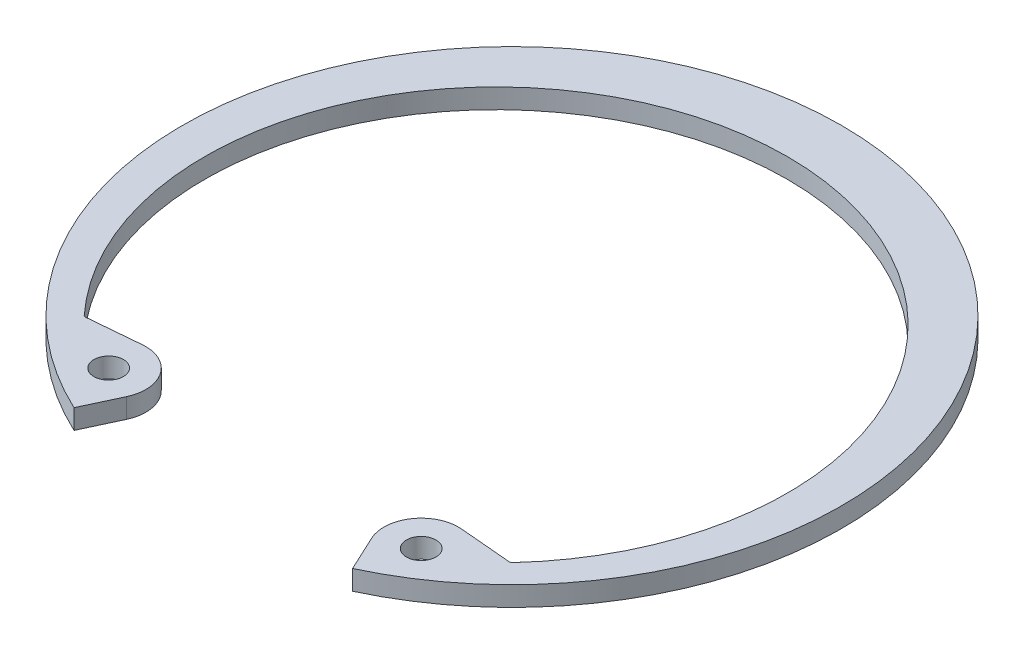
from build123d import *

# Parameters (mm, degrees)
SKETCH2_R      = 1.1811
EXTRUDE1_DEPTH = 1.5748
FILLET1_R      = 0.254


with BuildPart() as part:
    # Sketch2 → Extrude1 (new body)
    with BuildSketch(Plane(origin=(0, 0, 0), x_dir=(1, 0, 0), z_dir=(0, 1, 0))):
        with BuildLine():
            Line((11.120945987, -23.848945631), (9.784734318, -20.98343046))
            ThreePointArc((9.784734318, -20.98343046), (10.043743754, -18.022939056), (12.737109235, -16.767002106))
            Line((12.737109235, -16.767002106), (17.019050922, -17.141623461))
            ThreePointArc((17.019050922, -17.141623461), (0, 21.9964), (-17.019050922, -17.141623461))
            Line((-17.019050922, -17.141623461), (-12.737109235, -16.767002106))
            ThreePointArc((-12.737109235, -16.767002106), (-10.043743754, -18.022939056), (-9.784734318, -20.98343046))
            Line((-9.784734318, -20.98343046), (-11.120945987, -23.848945631))
            ThreePointArc((-11.120945987, -23.848945631), (0, 26.3144), (11.120945987, -23.848945631))
        make_face()
        with Locations(Location((12.478099799, -19.727493509, 0), (0, 0, 270))):
            Circle(SKETCH2_R, mode=Mode.SUBTRACT)
        with Locations(Location((-12.478099799, -19.727493509, 0), (0, 0, 270))):
            Circle(SKETCH2_R, mode=Mode.SUBTRACT)
    extrude(amount=-EXTRUDE1_DEPTH)

    # Fillet1
    fillet1_edges = [part.edges().sort_by_distance(p)[0] for p in [
        (17.019050922, -0.7874, 17.141623461),
        (-17.019050922, -0.7874, 17.141623461),
    ]]
    fillet(fillet1_edges, radius=FILLET1_R)


solid = part.part
